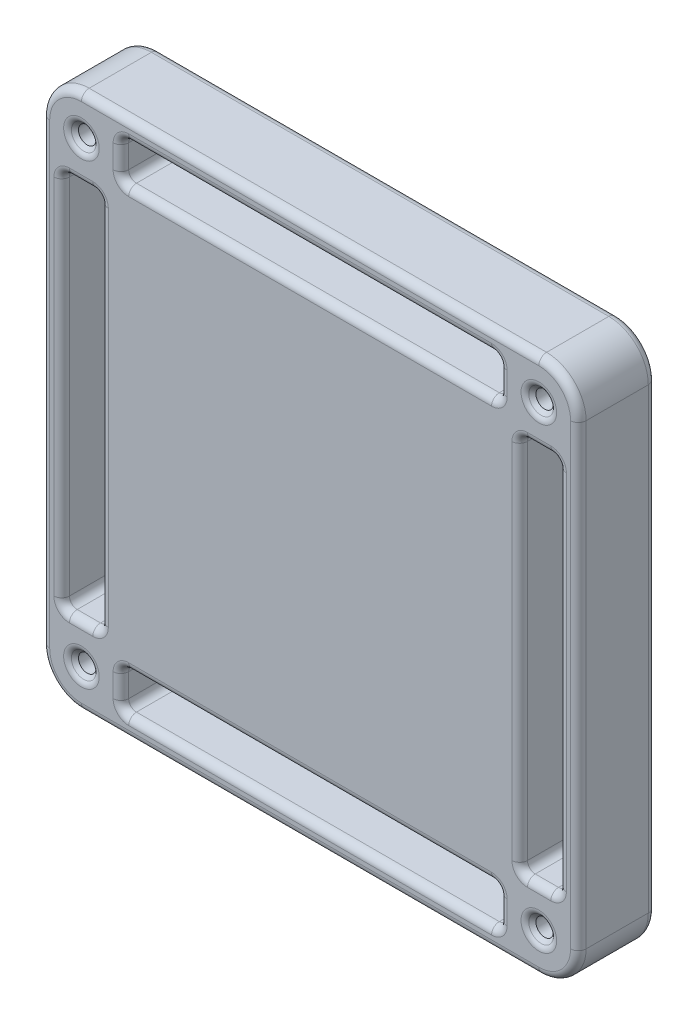
from build123d import *

# Parameters (mm, degrees)
SKETCH1_W                    = 69
SKETCH1_H                    = 69
BOSS_EXTRUDE1_DEPTH          = 10
FILLET1_R                    = 5.08
SKETCH3_R                    = 1.125
SKETCH3_W                    = 5
SKETCH3_H                    = 48.68
CUT_EXTRUDE1_DEPTH           = 10
CHAMFER1_SIZE                = 0.75
FILLET2_R                    = 1
CIRPATTERN1_COUNT            = 4
CHAMFER1_OF_CIRPATTERN1_SIZE = 0.75
FILLET2_OF_CIRPATTERN1_R     = 1


with BuildPart() as part:
    # Sketch1 → Boss-Extrude1 (new body)
    with BuildSketch(Plane(origin=(0, 0, 0), x_dir=(0, 1, 0), z_dir=(0, 0, 1))):
        with Locations((34.5, -34.5)):
            Rectangle(SKETCH1_W, SKETCH1_H)
    extrude(amount=BOSS_EXTRUDE1_DEPTH)

    # Fillet1
    fillet1_edges = [part.edges().sort_by_distance(p)[0] for p in [
        (0, 0, 5),
        (0, 69, 5),
        (69, 69, 5),
        (69, 0, 5),
    ]]
    fillet(fillet1_edges, radius=FILLET1_R)

    # Sketch3 → Cut-Extrude1 (cut)
    with BuildSketch(Plane.XY.offset(10)):
        with Locations((5.08, 63.92)):
            Circle(SKETCH3_R)
        with Locations((5.04, 34.5)):
            Rectangle(SKETCH3_W, SKETCH3_H)
    cut_extrude1 = extrude(amount=-CUT_EXTRUDE1_DEPTH, mode=Mode.SUBTRACT)

    # Chamfer1
    chamfer1_edges = [part.edges().sort_by_distance(p)[0] for p in [
        (3.955, 63.92, 0),
        (3.955, 63.92, 10),
    ]]
    chamfer(chamfer1_edges, length=CHAMFER1_SIZE)

    # Fillet2
    fillet2_edges = [part.edges().sort_by_distance(p)[0] for p in [
        (34.5, 0, 0),
        (34.5, 0, 10),
        (0, 34.5, 0),
        (34.5, 69, 0),
        (69, 34.5, 0),
        (67.512102448, 1.487897552, 0),
        (67.512102448, 67.512102448, 0),
        (1.487897552, 67.512102448, 0),
        (1.487897552, 1.487897552, 0),
        (0, 34.5, 10),
        (69, 34.5, 10),
        (34.5, 69, 10),
        (67.512102448, 1.487897552, 10),
        (67.512102448, 67.512102448, 10),
        (1.487897552, 67.512102448, 10),
        (1.487897552, 1.487897552, 10),
        (2.54, 34.5, 0),
        (2.54, 10.16, 5),
        (5.04, 58.84, 0),
        (2.54, 58.84, 5),
        (7.54, 34.5, 0),
        (7.54, 58.84, 5),
        (5.04, 10.16, 0),
        (7.54, 10.16, 5),
        (2.54, 34.5, 10),
        (5.04, 10.16, 10),
        (7.54, 34.5, 10),
        (5.04, 58.84, 10),
        (3.205, 63.92, 0),
        (3.205, 63.92, 10),
    ]]
    fillet(fillet2_edges, radius=FILLET2_R)

    # CirPattern1: Cut-Extrude1 ×4 about axis
    cirpattern1_axis = Axis((34.5, 34.5, 10), (0, 0, 1))
    for i in range(1, CIRPATTERN1_COUNT):
        add(cut_extrude1.rotate(cirpattern1_axis, i * 360 / CIRPATTERN1_COUNT), mode=Mode.SUBTRACT)

    # Chamfer1 of CirPattern1
    chamfer1_of_cirpattern1_edges = [part.edges().sort_by_distance(p)[0] for p in [
        (5.08, 3.955, 0),
        (5.08, 3.955, 10),
        (65.045, 5.08, 0),
        (65.045, 5.08, 10),
        (63.92, 65.045, 0),
        (63.92, 65.045, 10),
    ]]
    chamfer(chamfer1_of_cirpattern1_edges, length=CHAMFER1_OF_CIRPATTERN1_SIZE)

    # Fillet2 of CirPattern1
    fillet2_of_cirpattern1_edges = [part.edges().sort_by_distance(p)[0] for p in [
        (69, 34.5, 0),
        (69, 34.5, 10),
        (34.5, 0, 0),
        (0, 34.5, 0),
        (34.5, 69, 0),
        (67.512102448, 67.512102448, 0),
        (1.487897552, 67.512102448, 0),
        (1.487897552, 1.487897552, 0),
        (67.512102448, 1.487897552, 0),
        (34.5, 0, 10),
        (34.5, 69, 10),
        (0, 34.5, 10),
        (67.512102448, 67.512102448, 10),
        (1.487897552, 67.512102448, 10),
        (1.487897552, 1.487897552, 10),
        (67.512102448, 1.487897552, 10),
        (34.5, 2.54, 0),
        (58.84, 2.54, 5),
        (10.16, 5.04, 0),
        (10.16, 2.54, 5),
        (34.5, 7.54, 0),
        (10.16, 7.54, 5),
        (58.84, 5.04, 0),
        (58.84, 7.54, 5),
        (34.5, 2.54, 10),
        (58.84, 5.04, 10),
        (34.5, 7.54, 10),
        (10.16, 5.04, 10),
        (5.08, 3.205, 0),
        (5.08, 3.205, 10),
        (34.5, 69, 0),
        (34.5, 69, 10),
        (69, 34.5, 0),
        (34.5, 0, 0),
        (0, 34.5, 0),
        (1.487897552, 67.512102448, 0),
        (1.487897552, 1.487897552, 0),
        (67.512102448, 1.487897552, 0),
        (67.512102448, 67.512102448, 0),
        (69, 34.5, 10),
        (0, 34.5, 10),
        (34.5, 0, 10),
        (1.487897552, 67.512102448, 10),
        (1.487897552, 1.487897552, 10),
        (67.512102448, 1.487897552, 10),
        (67.512102448, 67.512102448, 10),
        (66.46, 34.5, 0),
        (66.46, 58.84, 5),
        (63.96, 10.16, 0),
        (66.46, 10.16, 5),
        (61.46, 34.5, 0),
        (61.46, 10.16, 5),
        (63.96, 58.84, 0),
        (61.46, 58.84, 5),
        (66.46, 34.5, 10),
        (63.96, 58.84, 10),
        (61.46, 34.5, 10),
        (63.96, 10.16, 10),
        (65.795, 5.08, 0),
        (65.795, 5.08, 10),
        (0, 34.5, 0),
        (0, 34.5, 10),
        (34.5, 69, 0),
        (69, 34.5, 0),
        (34.5, 0, 0),
        (1.487897552, 1.487897552, 0),
        (67.512102448, 1.487897552, 0),
        (67.512102448, 67.512102448, 0),
        (1.487897552, 67.512102448, 0),
        (34.5, 69, 10),
        (34.5, 0, 10),
        (69, 34.5, 10),
        (1.487897552, 1.487897552, 10),
        (67.512102448, 1.487897552, 10),
        (67.512102448, 67.512102448, 10),
        (1.487897552, 67.512102448, 10),
        (34.5, 66.46, 0),
        (10.16, 66.46, 5),
        (58.84, 63.96, 0),
        (58.84, 66.46, 5),
        (34.5, 61.46, 0),
        (58.84, 61.46, 5),
        (10.16, 63.96, 0),
        (10.16, 61.46, 5),
        (34.5, 66.46, 10),
        (10.16, 63.96, 10),
        (34.5, 61.46, 10),
        (58.84, 63.96, 10),
        (63.92, 65.795, 0),
        (63.92, 65.795, 10),
    ]]
    fillet(fillet2_of_cirpattern1_edges, radius=FILLET2_OF_CIRPATTERN1_R)


solid = part.part
